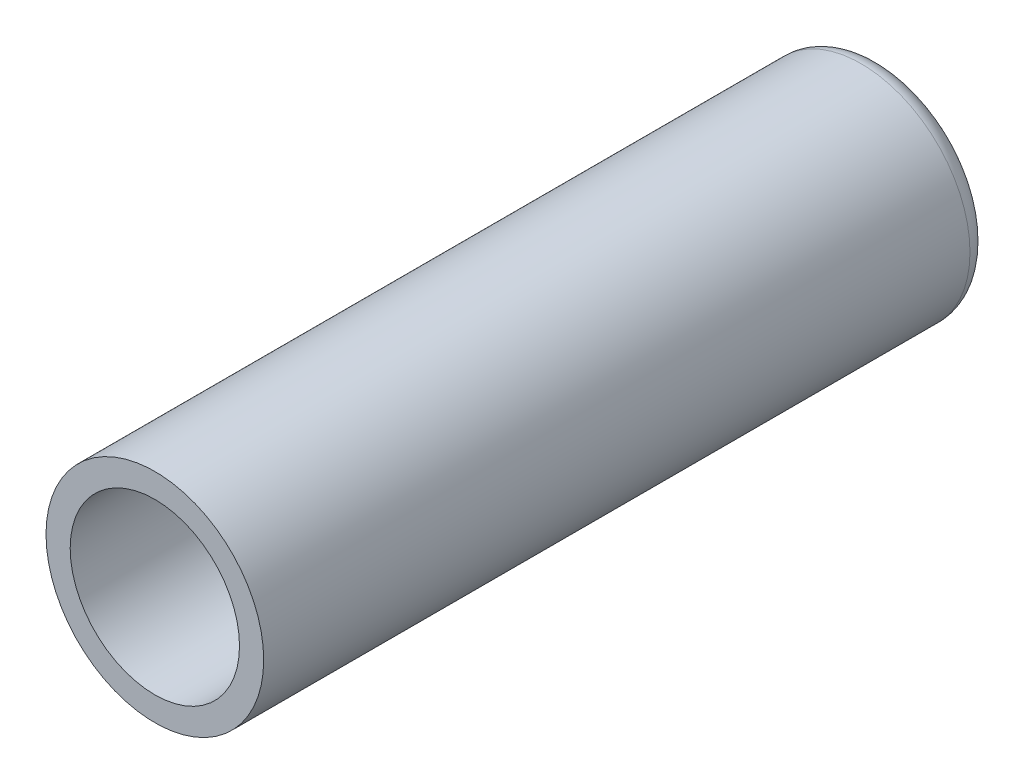
from build123d import *

# Parameters (mm, degrees)
SKETCH1_R           = 14.2875
BOSS_EXTRUDE1_DEPTH = 95.25
SKETCH2_R           = 11.1125
CUT_EXTRUDE1_DEPTH  = 92.075
FILLET1_R           = 2.54


with BuildPart() as part:
    # Sketch1 → Boss-Extrude1 (new body)
    with BuildSketch(Plane.XY):
        Circle(SKETCH1_R)
    extrude(amount=BOSS_EXTRUDE1_DEPTH)

    # Sketch2 → Cut-Extrude1 (cut)
    with BuildSketch(Plane.XY.offset(95.25)):
        Circle(SKETCH2_R)
    extrude(amount=-CUT_EXTRUDE1_DEPTH, mode=Mode.SUBTRACT)

    # Fillet1
    fillet1_edges = [part.edges().sort_by_distance(p)[0] for p in [
        (-14.2875, 0, 0),
    ]]
    fillet(fillet1_edges, radius=FILLET1_R)


solid = part.part
